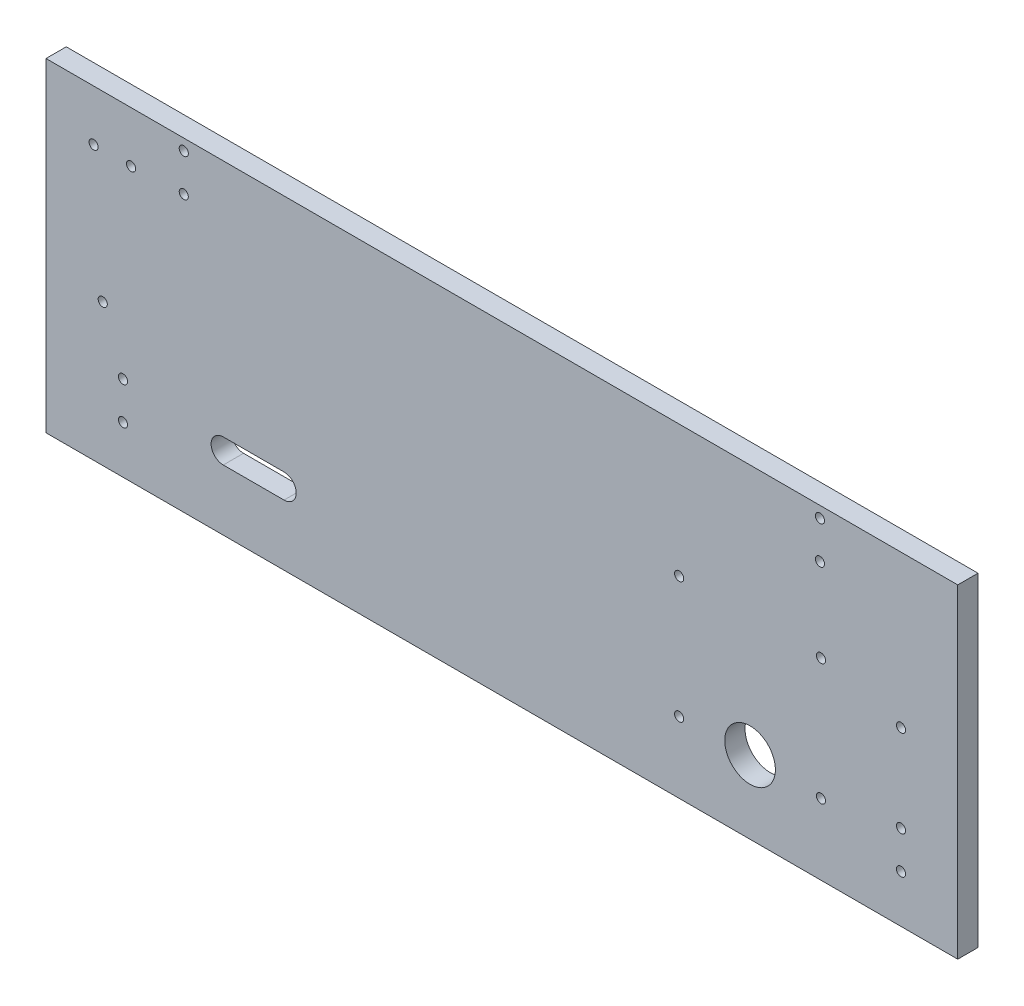
from build123d import *

# Parameters (mm, degrees)
SCHIZZO1_W                   = 450
SCHIZZO1_H                   = 160
ESTRUSIONE_ESTRUSIONE1_DEPTH = 10
SCHIZZO2_R                   = 12.5
SCHIZZO2_R_2                 = 2.25
TAGLIO_ESTRUSIONE1_DEPTH     = 10


with BuildPart() as part:
    # Schizzo1 → Estrusione-Estrusione1 (new body)
    with BuildSketch(Plane.XY):
        with Locations((225, 80)):
            Rectangle(SCHIZZO1_W, SCHIZZO1_H)
    extrude(amount=ESTRUSIONE_ESTRUSIONE1_DEPTH)

    # Schizzo2 → Taglio-Estrusione1 (cut)
    with BuildSketch(Plane.XY.offset(10)):
        with Locations((347.5, 36)):
            Circle(SCHIZZO2_R)
        with Locations((382, 154.5)):
            Circle(SCHIZZO2_R_2)
        with Locations((382, 136)):
            Circle(SCHIZZO2_R_2)
        with Locations((68, 154.5)):
            Circle(SCHIZZO2_R_2)
        with Locations((68, 136)):
            Circle(SCHIZZO2_R_2)
        with Locations((38, 42)):
            Circle(SCHIZZO2_R_2)
        with Locations((38, 23.5)):
            Circle(SCHIZZO2_R_2)
        with Locations((422, 23.5)):
            Circle(SCHIZZO2_R_2)
        with Locations((422, 42)):
            Circle(SCHIZZO2_R_2)
        with Locations((23.5, 134.933694222)):
            Circle(SCHIZZO2_R_2)
        with Locations((42, 134.933694222)):
            Circle(SCHIZZO2_R_2)
        with Locations((28, 70)):
            Circle(SCHIZZO2_R_2)
        with Locations((422, 85)):
            Circle(SCHIZZO2_R_2)
        with Locations((312.5, 95)):
            Circle(SCHIZZO2_R_2)
        with Locations((382.5, 95)):
            Circle(SCHIZZO2_R_2)
        with Locations((382.5, 35)):
            Circle(SCHIZZO2_R_2)
        with Locations((312.5, 35)):
            Circle(SCHIZZO2_R_2)
        with BuildLine():
            Line((87.5, 42), (117.5, 42))
            ThreePointArc((117.5, 42), (123.5, 36), (117.5, 30))
            Line((117.5, 30), (87.5, 30))
            ThreePointArc((87.5, 30), (81.5, 36), (87.5, 42))
        make_face()
    extrude(amount=-TAGLIO_ESTRUSIONE1_DEPTH, mode=Mode.SUBTRACT)


solid = part.part
